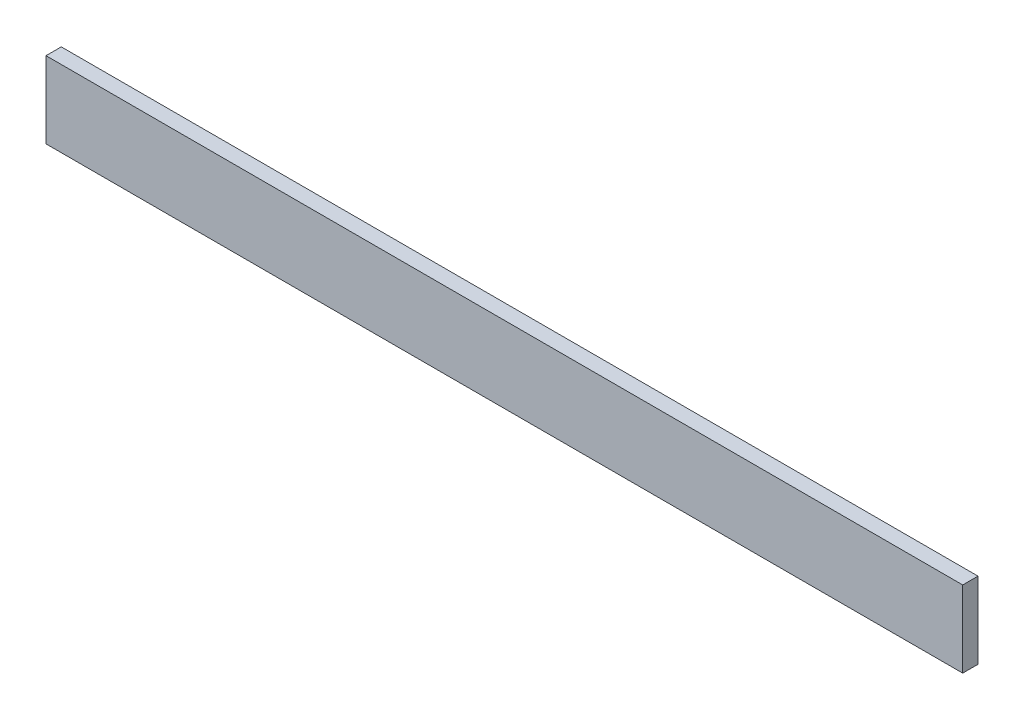
from build123d import *

# Parameters (mm, degrees)
ESQUISSE1_W        = 180
ESQUISSE1_H        = 15
BOSS_EXTRU_1_DEPTH = 3


with BuildPart() as part:
    # Esquisse1 → Boss.-Extru.1 (new body)
    with BuildSketch(Plane.XY):
        with Locations((-90, 7.5)):
            Rectangle(ESQUISSE1_W, ESQUISSE1_H)
    extrude(amount=BOSS_EXTRU_1_DEPTH)


solid = part.part
